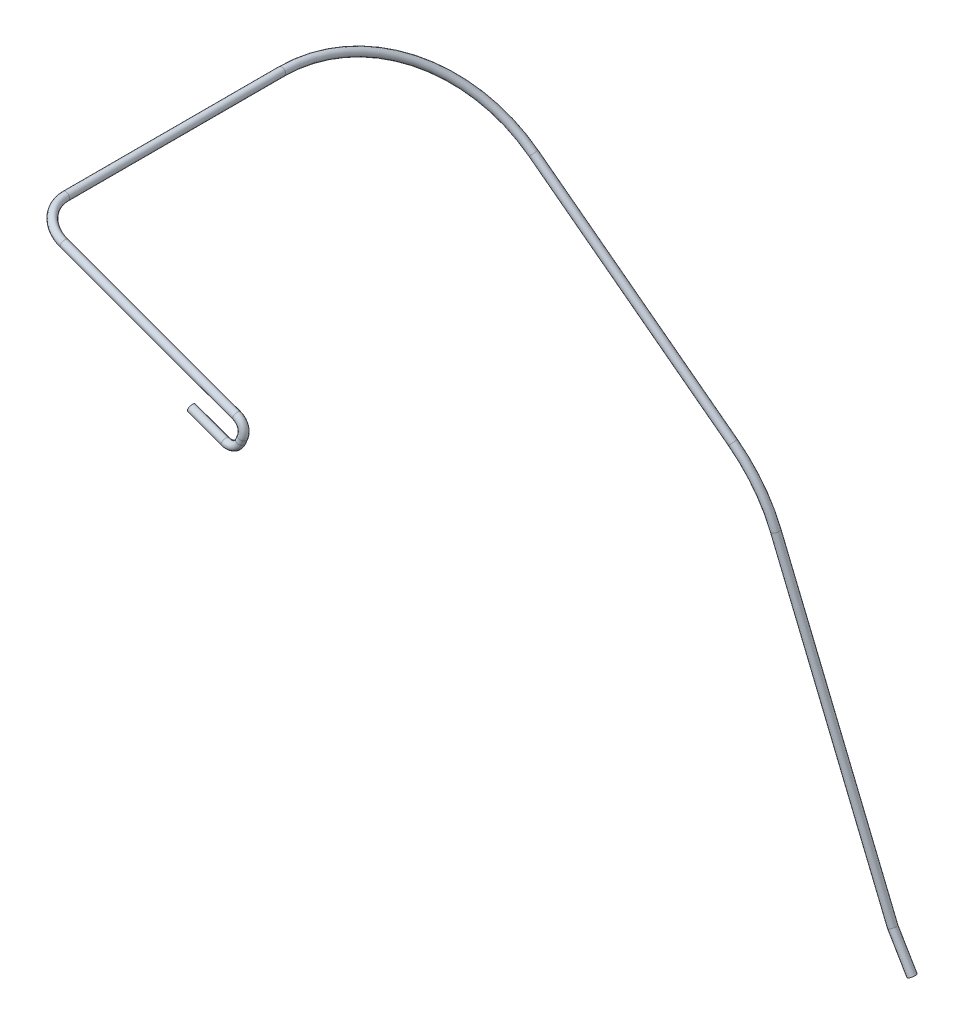
from build123d import *

# Parameters (mm, degrees)
SWEEP_THIN1_PROFILE_R   = 5
SWEEP_THIN1_PROFILE_R_2 = 4


with BuildPart() as part:
    # Sweep-Thin1: sweep along a curve in space
    with BuildLine() as sweep_thin1_path:
        Line((0, 0, 0), (43.479870696, -15.825378723, 0))
        ThreePointArc((62.709599984, -6.848890283, -1.151139577), (54.970468973, -15.324853075, -0.337422886), (43.479870696, -15.825378723, 0))
        Line((64.725019351, -1.246195083, -1.60770673), (62.709599984, -6.848890283, -1.151139577))
        ThreePointArc((64.725019351, -1.246195083, -1.60770673), (64.182661882, 10.166933384, -2.415871504), (55.725860842, 17.885578681, -2.750257937))
        Line((55.725860842, 17.885578681, -2.750257937), (-167.617948509, 99.176077292, -2.750257937))
        ThreePointArc((-167.617948509, 99.176077292, -2.750257937), (-194.196469484, 108.849867798, -14.465986689), (-205.20565334, 112.856883025, -42.750257937))
        Line((-205.20565334, 112.856883025, -42.750257937), (-205.20565334, 112.856883025, -322.093656878))
        ThreePointArc((-205.20565334, 112.856883025, -322.093656878), (-168.920320359, 76.192839016, -456.155583569), (-78.781636639, -14.88662465, -521.063415888))
        Line((-78.781636639, -14.88662465, -521.063415888), (146.440789385, -242.459703389, -553.6880229))
        ThreePointArc((146.440789385, -242.459703389, -553.6880229), (174.976176905, -278.969214209, -557.980907951), (194.347006474, -321.155510877, -561.256410736))
        Line((194.347006474, -321.155510877, -561.256410736), (321.647370226, -712.78578901, -585.157444605))
        Line((321.647370226, -712.78578901, -585.157444605), (345.043830557, -756.94277999, -586.820511541))
    # Sweep-Thin1 profile (on start of the path) → Sweep-Thin1 (sweep)
    with BuildSketch(Plane(origin=(0, 0, 0), x_dir=(0.34202014332566943, 0.9396926207859082, 0), z_dir=(0.9396926207859082, -0.34202014332566943, 0))):
        Circle(SWEEP_THIN1_PROFILE_R)
        Circle(SWEEP_THIN1_PROFILE_R_2, mode=Mode.SUBTRACT)
    sweep(path=sweep_thin1_path.line, transition=Transition.RIGHT)


solid = part.part
